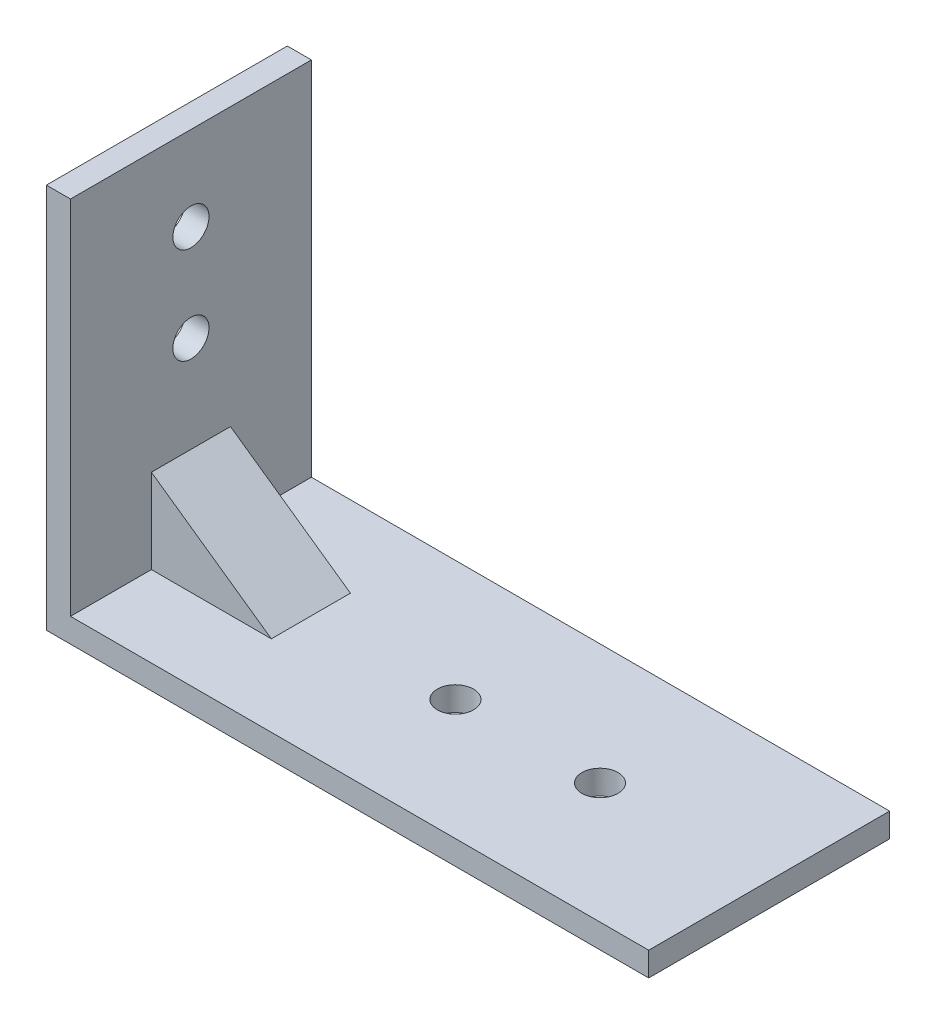
from build123d import *

# Parameters (mm, degrees)
SKETCH1_W           = 50
SKETCH1_H           = 20
BOSS_EXTRUDE1_DEPTH = 2
SKETCH2_W           = 2
SKETCH2_H           = 20
BOSS_EXTRUDE2_DEPTH = 30
SKETCH4_W           = 9.955385113
SKETCH4_H           = 6.56478527
BOSS_EXTRUDE3_DEPTH = 7
CUT_EXTRUDE1_DEPTH  = 7
SKETCH6_R           = 1.5
CUT_EXTRUDE2_DEPTH  = 7
SKETCH7_R           = 1.5
CUT_EXTRUDE3_DEPTH  = 7


with BuildPart() as part:
    # Sketch1 → Boss-Extrude1 (new body)
    with BuildSketch(Plane(origin=(0, 0, 0), x_dir=(1, 0, 0), z_dir=(0, 1, 0))):
        with Locations((25, 10)):
            Rectangle(SKETCH1_W, SKETCH1_H)
    extrude(amount=BOSS_EXTRUDE1_DEPTH)

    # Sketch2 → Boss-Extrude2 (add)
    with BuildSketch(Plane(origin=(0, 2, 0), x_dir=(1, 0, 0), z_dir=(0, 1, 0))):
        with Locations((1, 10)):
            Rectangle(SKETCH2_W, SKETCH2_H)
    extrude(amount=BOSS_EXTRUDE2_DEPTH)

    # Sketch4 → Boss-Extrude3 (add)
    with BuildSketch(Plane(origin=(0, 2, 0), x_dir=(1, 0, 0), z_dir=(0, 1, 0))):
        with Locations((6.977692557, 10.002392635)):
            Rectangle(SKETCH4_W, SKETCH4_H)
    extrude(amount=BOSS_EXTRUDE3_DEPTH)

    # Sketch5 → Cut-Extrude1 (cut)
    with BuildSketch(Plane.XY.offset(-6.72)):
        Polygon((2, 9), (11.955385113, 2), (11.955385113, 9), align=None)
    extrude(amount=-CUT_EXTRUDE1_DEPTH, mode=Mode.SUBTRACT)

    # Sketch6 → Cut-Extrude2 (cut)
    with BuildSketch(Plane(origin=(0, 2, 0), x_dir=(1, 0, 0), z_dir=(0, 1, 0))):
        with Locations(Location((23.955385113, 10, 0), (0, 0, 270))):
            Circle(SKETCH6_R)
        with Locations(Location((35.955385113, 10, 0), (0, 0, 270))):
            Circle(SKETCH6_R)
    extrude(amount=-CUT_EXTRUDE2_DEPTH, mode=Mode.SUBTRACT)

    # Sketch7 → Cut-Extrude3 (cut)
    with BuildSketch(Plane(origin=(2, 0, 0), x_dir=(0, 0, -1), z_dir=(1, 0, 0))):
        with Locations((10.001560414, 17)):
            Circle(SKETCH7_R)
        with Locations((10.000728193, 24.999999957)):
            Circle(SKETCH7_R)
    extrude(amount=-CUT_EXTRUDE3_DEPTH, mode=Mode.SUBTRACT)


solid = part.part
